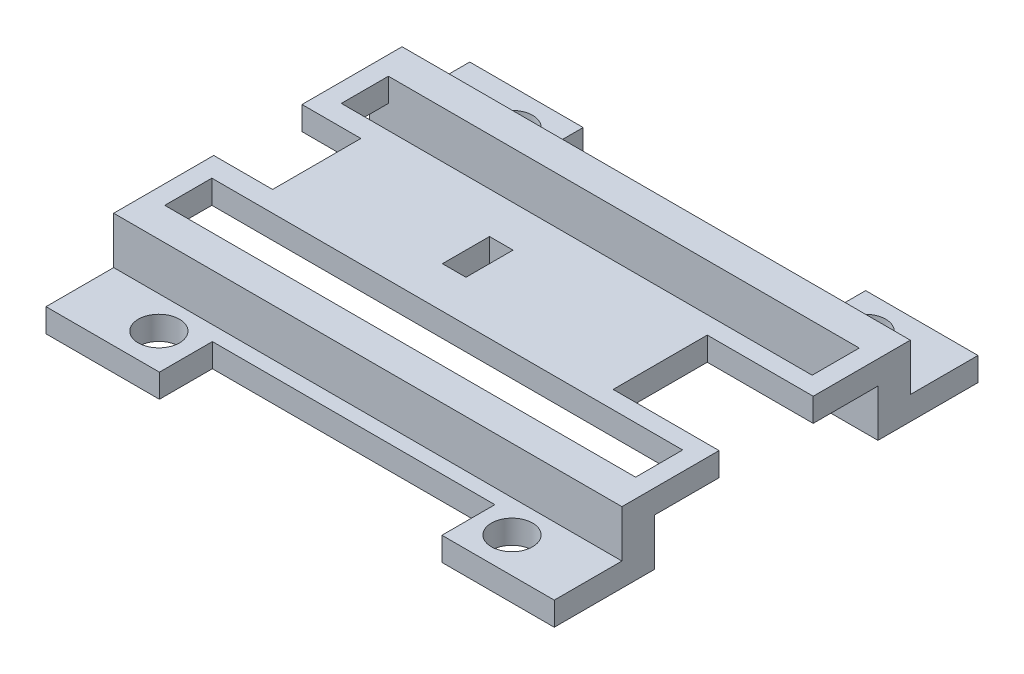
from build123d import *

# Parameters (mm, degrees)
SKETCH1_R               = 1.75
BOSS_EXTRUDE3_DEPTH     = 3
SKETCH4_W               = 38.009499712
SKETCH4_H               = 2.5
CUT_EXTRUDE7_DEPTH      = 29.268853886
SKETCH7_W               = 36
SKETCH7_H               = 1
CUT_EXTRUDE8_DEPTH      = 47.877632193
SKETCH9_W               = 39.982004405
SKETCH9_H               = 3.901650926
SKETCH9_W_2             = 38.509499712
SKETCH9_H_2             = 2.8
SKETCH9_W_3             = 37.982004405
SKETCH9_H_3             = 0.55
CUT_EXTRUDE9_DEPTH      = 10
SKETCH10_W              = 40
SKETCH10_H              = 4
SKETCH10_W_2            = 39.982004405
SKETCH10_H_2            = 3.901650926
CUT_EXTRUDE11_DEPTH     = 29.180278565
SKETCH11_W              = 20
SKETCH11_H              = 3.116121774
CUT_EXTRUDE12_DEPTH     = 10
SKETCH12_W              = 2
SKETCH12_H              = 8.5
CUT_EXTRUDE15_DEPTH     = 10
CROQUIS1_W              = 24
CROQUIS1_H              = 4
SALIENTE_EXTRUIR1_DEPTH = 2
CROQUIS2_W              = 40
CROQUIS2_H              = 4
SALIENTE_EXTRUIR2_DEPTH = 4
CORTAR_EXTRUIR2_DEPTH   = 4
SKETCH3_W               = 9
SKETCH3_H               = 3.998143652
CORTAR_EXTRUIR5_DEPTH   = 4


with BuildPart() as part:
    # Sketch1 → Boss-Extrude3 (new body)
    # profile 1 of 2: a face of its own
    with BuildSketch(Plane(origin=(0, 0, 0), x_dir=(1, 0, 0), z_dir=(0, 1, 0))):
        Polygon((-21.59, 18), (-21.59, 0), (0, 0), (21.59, 0), (21.59, 18), (18.04585781, 18), (10.04585781, 18), (10.04585781, 12.616121774), (-9.95414219, 12.616121774), (-9.95414219, 18), (-17.95414219, 18), align=None)
        with Locations(Location((-15, 15, 0), (0, 0, 270))):
            Circle(SKETCH1_R, mode=Mode.SUBTRACT)
        Polygon((18.504745017, 6.25), (0, 6.25), (-18.5, 6.25), (-19.004539265, 6.25), (-19.004539265, 8.75), (-18.5, 8.75), (0.002372509, 8.75), (18.504745017, 8.75), (19.004960447, 8.75), (19.004960447, 6.25), align=None, mode=Mode.SUBTRACT)
        with Locations(Location((15, 15, 0), (0, 0, 270))):
            Circle(SKETCH1_R, mode=Mode.SUBTRACT)
    # profile 2 of 2: a face of its own
    with BuildSketch(Plane(origin=(0, 0, 0), x_dir=(1, 0, 0), z_dir=(0, 1, 0))):
        Polygon((0, 0), (-21.59, 0), (-21.59, -18), (-17.95414219, -18), (-9.95414219, -18), (-9.95414219, -12.616121774), (10.04585781, -12.616121774), (10.04585781, -18), (18.04585781, -18), (21.59, -18), (21.59, 0), align=None)
        with Locations(Location((-15, -15, 0), (0, 0, 270))):
            Circle(SKETCH1_R, mode=Mode.SUBTRACT)
        with Locations(Location((15, -15, 0), (0, 0, 270))):
            Circle(SKETCH1_R, mode=Mode.SUBTRACT)
        Polygon((18.504745017, -6.25), (19.004960447, -6.25), (19.004960447, -8.75), (18.504745017, -8.75), (-18.5, -8.75), (-19.004539265, -8.75), (-19.004539265, -6.25), (-18.5, -6.25), align=None, mode=Mode.SUBTRACT)
    extrude(amount=BOSS_EXTRUDE3_DEPTH)

    # Sketch4 → Cut-Extrude7 (cut, through all)
    # profile 1 of 3: a face of its own
    with BuildSketch(Plane(origin=(0, 3, 0), x_dir=(1, 0, 0), z_dir=(0, 1, 0))):
        Polygon((19.004960447, 6.1), (19.254960447, 6.1), (19.254960447, 8.882786661), (19.254960447, 8.9), (19.004960447, 8.9), (-19.004539265, 8.9), (-19.254539265, 8.9), (-19.254539265, 6.1), (-19.004539265, 6.1), align=None)
        with Locations((0.000210591, 7.5)):
            Rectangle(SKETCH4_W, SKETCH4_H, mode=Mode.SUBTRACT)
    # profile 2 of 3: a face of its own
    with BuildSketch(Plane(origin=(0, 3, 0), x_dir=(1, 0, 0), z_dir=(0, 1, 0))):
        with Locations((0.000210591, 7.5)):
            Rectangle(SKETCH4_W, SKETCH4_H)
    # profile 3 of 3: a face of its own
    with BuildSketch(Plane(origin=(0, 3, 0), x_dir=(1, 0, 0), z_dir=(0, 1, 0))):
        Polygon((-19.254539265, -6.1), (-19.254539265, -8.9), (-19.004539265, -8.9), (19.004960447, -8.9), (19.254960447, -8.9), (19.254960447, -6.1), (19.004960447, -6.1), (-19.004539265, -6.1), align=None)
        with Locations((0.000210591, -7.5)):
            Rectangle(SKETCH4_W, SKETCH4_H, mode=Mode.SUBTRACT)
    extrude(amount=-CUT_EXTRUDE7_DEPTH, mode=Mode.SUBTRACT)

    # Sketch7 → Cut-Extrude8 (cut, through all)
    with BuildSketch(Plane(origin=(21.59, 0, 0), x_dir=(0, 0, -1), z_dir=(1, 0, 0))):
        with Locations((0, 0.5)):
            Rectangle(SKETCH7_W, SKETCH7_H)
    extrude(amount=-CUT_EXTRUDE8_DEPTH, mode=Mode.SUBTRACT)

    # Sketch9 → Cut-Extrude9 (cut)
    # profile 1 of 4: a face of its own
    with BuildSketch(Plane(origin=(0, 3, 0), x_dir=(1, 0, 0), z_dir=(0, 1, 0))):
        with Locations((0.000210592, 7.5)):
            Rectangle(SKETCH9_W, SKETCH9_H)
        with Locations((0.000210591, 7.5)):
            Rectangle(SKETCH9_W_2, SKETCH9_H_2, mode=Mode.SUBTRACT)
    # profile 2 of 4: a face of its own
    with BuildSketch(Plane(origin=(0, 3, 0), x_dir=(1, 0, 0), z_dir=(0, 1, 0))):
        with Locations((0.000210592, -7.5)):
            Rectangle(SKETCH9_W, SKETCH9_H)
        Polygon((-19.254539265, -8.9), (-19.254539265, -6.1), (-18.990791611, -6.1), (-18.990791611, -5.55), (18.991212794, -5.55), (18.991212794, -6.1), (19.254960447, -6.1), (19.254960447, -8.9), (18.991212794, -8.9), (18.991212794, -9.45), (-18.990791611, -9.45), (-18.990791611, -8.9), align=None, mode=Mode.SUBTRACT)
    # profile 3 of 4: a face of its own
    with BuildSketch(Plane(origin=(0, 3, 0), x_dir=(1, 0, 0), z_dir=(0, 1, 0))):
        with Locations((0.000210592, -5.825)):
            Rectangle(SKETCH9_W_3, SKETCH9_H_3)
    # profile 4 of 4: a face of its own
    with BuildSketch(Plane(origin=(0, 3, 0), x_dir=(1, 0, 0), z_dir=(0, 1, 0))):
        with Locations((0.000210592, -9.175)):
            Rectangle(SKETCH9_W_3, SKETCH9_H_3)
    extrude(amount=-CUT_EXTRUDE9_DEPTH, mode=Mode.SUBTRACT)

    # Sketch10 → Cut-Extrude11 (cut, through all)
    # profile 1 of 3: a face of its own
    with BuildSketch(Plane(origin=(0, 3, 0), x_dir=(1, 0, 0), z_dir=(0, 1, 0))):
        with Locations((0.000210591, -7.5)):
            Rectangle(SKETCH10_W, SKETCH10_H)
        with Locations((0.000210592, -7.5)):
            Rectangle(SKETCH10_W_2, SKETCH10_H_2, mode=Mode.SUBTRACT)
    # profile 2 of 3: a face of its own
    with BuildSketch(Plane(origin=(0, 3, 0), x_dir=(1, 0, 0), z_dir=(0, 1, 0))):
        with Locations((0.000210591, 7.5)):
            Rectangle(SKETCH10_W, SKETCH10_H)
        with Locations((0.000210592, 7.5)):
            Rectangle(SKETCH10_W_2, SKETCH10_H_2, mode=Mode.SUBTRACT)
    # profile 3 of 3: a face of its own
    with BuildSketch(Plane(origin=(0, 3, 0), x_dir=(1, 0, 0), z_dir=(0, 1, 0))):
        with Locations((0.000210592, 7.5)):
            Rectangle(SKETCH10_W_2, SKETCH10_H_2)
    extrude(amount=-CUT_EXTRUDE11_DEPTH, mode=Mode.SUBTRACT)

    # Sketch11 → Cut-Extrude12 (cut)
    with BuildSketch(Plane(origin=(0, 3, 0), x_dir=(1, 0, 0), z_dir=(0, 1, 0))):
        with Locations((0.04585781, -11.058060887)):
            Rectangle(SKETCH11_W, SKETCH11_H)
        with Locations((0.04585781, 11.058060887)):
            Rectangle(SKETCH11_W, SKETCH11_H)
    extrude(amount=-CUT_EXTRUDE12_DEPTH, mode=Mode.SUBTRACT)

    # Sketch12 → Cut-Extrude15 (cut)
    with BuildSketch(Plane(origin=(0, 3, 0), x_dir=(1, 0, 0), z_dir=(0, 1, 0))):
        with Locations((-10.95414219, -13.75)):
            Rectangle(SKETCH12_W, SKETCH12_H)
        with Locations((-10.95414219, 13.75)):
            Rectangle(SKETCH12_W, SKETCH12_H)
        with Locations((11.04585781, 13.75)):
            Rectangle(SKETCH12_W, SKETCH12_H)
        Polygon((10.04585781, -9.65592739), (10.04585781, -18), (12.04585781, -18), (12.04585781, -9.65592739), (12.04585781, -9.5), (10.04585781, -9.5), align=None)
    extrude(amount=-CUT_EXTRUDE15_DEPTH, mode=Mode.SUBTRACT)

    # Croquis1 → Saliente-Extruir1 (add)
    with BuildSketch(Plane(origin=(0, 3, 0), x_dir=(1, 0, 0), z_dir=(0, 1, 0))):
        with Locations((0.04585781, -11.5)):
            Rectangle(CROQUIS1_W, CROQUIS1_H)
        with Locations((0.04585781, 11.5)):
            Rectangle(CROQUIS1_W, CROQUIS1_H)
    extrude(amount=-SALIENTE_EXTRUIR1_DEPTH)

    # Croquis2 → Saliente-Extruir2 (add)
    with BuildSketch(Plane(origin=(0, 3, 0), x_dir=(1, 0, 0), z_dir=(0, 1, 0))):
        Polygon((21.59, 9.27), (21.59, 12.25), (-21.59, 12.25), (-21.59, 9.27), (-21.59, -9.27), (-21.59, -12.25), (21.59, -12.25), (21.59, -9.27), align=None)
        with Locations((0.000210591, -7.5)):
            Rectangle(CROQUIS2_W, CROQUIS2_H, mode=Mode.SUBTRACT)
        with Locations((0.000210591, 7.5)):
            Rectangle(CROQUIS2_W, CROQUIS2_H, mode=Mode.SUBTRACT)
    extrude(amount=SALIENTE_EXTRUIR2_DEPTH)

    # Croquis4 → Cortar-Extruir2 (cut)
    with BuildSketch(Plane.XZ.offset(-1)):
        Polygon((-21.59, -9.5), (-21.59, 9.5), (-19.999789409, 9.5), (-19.999789409, 5.5), (20.000210591, 5.5), (20.000210591, 9.5), (21.59, 9.5), (21.59, -9.5), (20.000210591, -9.5), (20.000210591, -5.5), (-19.999789409, -5.5), (-19.999789409, -9.5), align=None)
    extrude(amount=-CORTAR_EXTRUIR2_DEPTH, mode=Mode.SUBTRACT)

    # Sketch3 → Cortar-Extruir5 (cut)
    with BuildSketch(Plane(origin=(0, 3, 0), x_dir=(1, 0, 0), z_dir=(0, 1, 0))):
        Polygon((-1.911780511, -2), (-1.911780511, 0), (-3.40804733, 0), (-3.911780511, 0), (-3.911780511, -0.084828213), (-3.911780511, -2), align=None)
        Polygon((-3.40804733, 0), (-1.911780511, 0), (-1.911780511, 2), (-3.911780511, 2), (-3.911780511, 0), align=None)
        Polygon((12.59, 0.000697543), (12.59, 0), (21.59, 0), (21.59, 3.999538738), (12.59, 3.999538738), align=None)
        with Locations((17.09, -1.999071826)):
            Rectangle(SKETCH3_W, SKETCH3_H)
        Polygon((-16.59, -3.75), (-16.59, 0), (-16.59, 3.75), (-21.59, 3.75), (-21.59, 0), (-21.59, -3.75), align=None)
    extrude(amount=CORTAR_EXTRUIR5_DEPTH, mode=Mode.SUBTRACT)


solid = part.part
